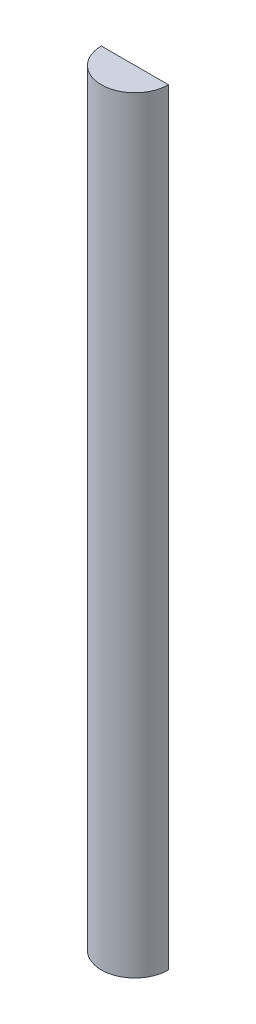
from build123d import *

# Parameters (mm, degrees)
SKETCH1_W      = 6.35
SKETCH1_H      = 145
REVOLVE1_ANGLE = 180


with BuildPart() as part:
    # Sketch1 → Revolve1 (revolve)
    with BuildSketch(Plane.XY):
        with Locations((3.175, 72.5)):
            Rectangle(SKETCH1_W, SKETCH1_H)
    revolve(axis=Axis((0, 140.431855582, 0), (0, -1, 0)), revolution_arc=REVOLVE1_ANGLE)


solid = part.part
